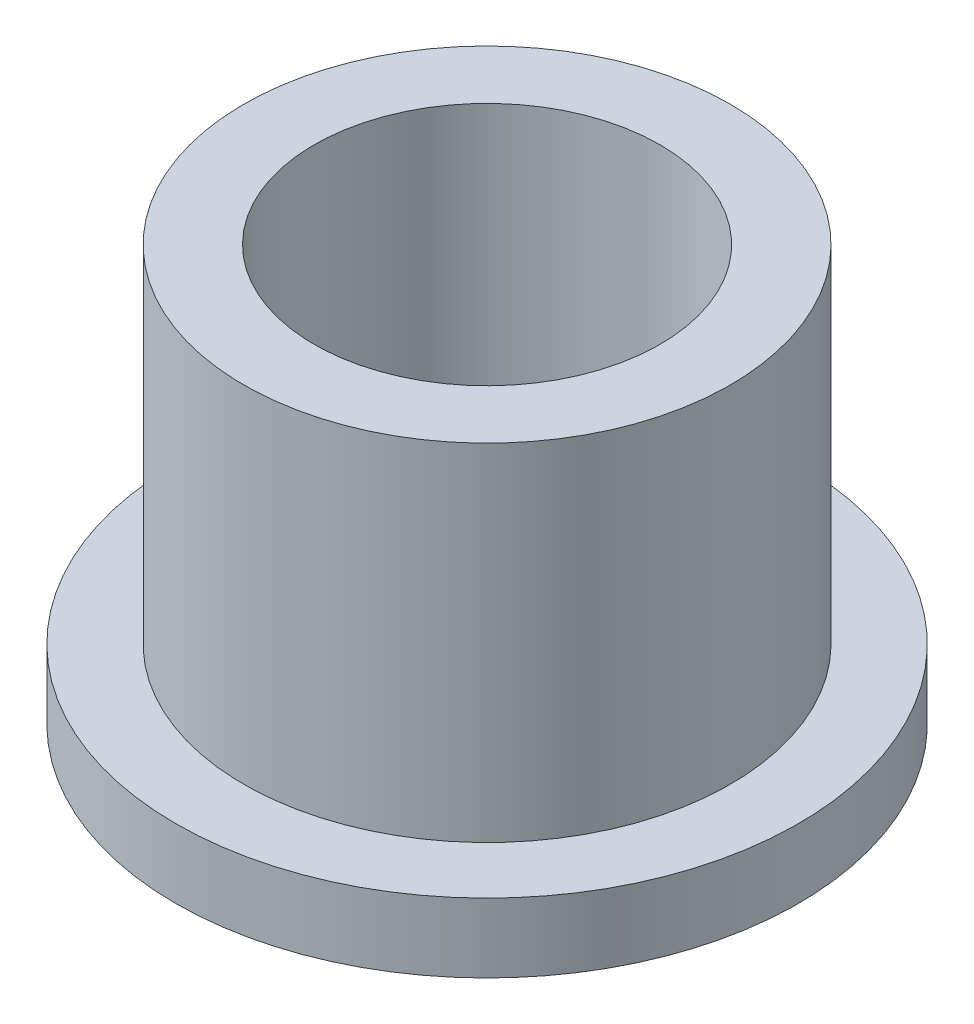
from build123d import *

# Parameters (mm, degrees)
SKETCH2_R           = 5.58165
SKETCH2_R_2         = 3.96875
BOSS_EXTRUDE1_DEPTH = 9.525
SKETCH3_R           = 7.14375
SKETCH3_R_2         = 5.58165
BOSS_EXTRUDE2_DEPTH = 1.5875


with BuildPart() as part:
    # Sketch2 → Boss-Extrude1 (new body)
    with BuildSketch(Plane(origin=(0, 0, 0), x_dir=(1, 0, 0), z_dir=(0, 1, 0))):
        with Locations(Location((0, 0, 0), (0, 0, 90))):
            Circle(SKETCH2_R)
        with Locations(Location((0, 0, 0), (0, 0, 90))):
            Circle(SKETCH2_R_2, mode=Mode.SUBTRACT)
    extrude(amount=BOSS_EXTRUDE1_DEPTH)

    # Sketch3 → Boss-Extrude2 (add)
    with BuildSketch(Plane(origin=(0, 0, 0), x_dir=(1, 0, 0), z_dir=(0, 1, 0))):
        with Locations(Location((0, 0, 0), (0, 0, 270))):
            Circle(SKETCH3_R)
        with Locations(Location((0, 0, 0), (0, 0, 90))):
            Circle(SKETCH3_R_2, mode=Mode.SUBTRACT)
    extrude(amount=BOSS_EXTRUDE2_DEPTH)


solid = part.part
